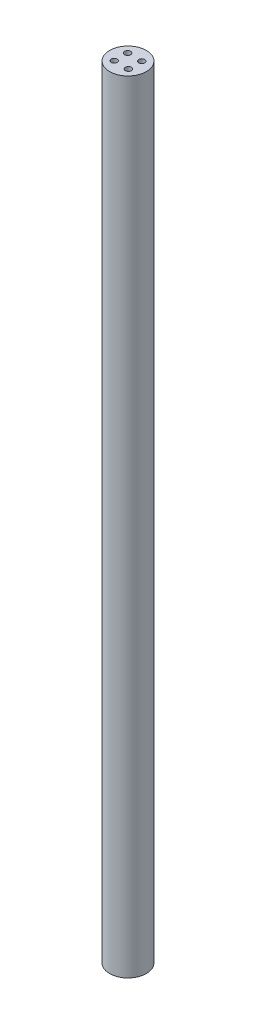
from build123d import *

# Parameters (mm, degrees)
SKETCH1_R           = 2.3876
BOSS_EXTRUDE1_DEPTH = 101.6
SKETCH2_R           = 0.3937
CUT_EXTRUDE1_DEPTH  = 102.656093116


with BuildPart() as part:
    # Sketch1 → Boss-Extrude1 (new body)
    with BuildSketch(Plane(origin=(0, 0, 0), x_dir=(1, 0, 0), z_dir=(0, 1, 0))):
        with Locations(Location((0, 0, 0), (0, 0, 270))):
            Circle(SKETCH1_R)
    extrude(amount=BOSS_EXTRUDE1_DEPTH)

    # Sketch2 → Cut-Extrude1 (cut, through all)
    with BuildSketch(Plane(origin=(0, 101.6, 0), x_dir=(1, 0, 0), z_dir=(0, 1, 0))):
        with Locations(Location((-0.923475175, 0.871833471, 0), (0, 0, 270))):
            Circle(SKETCH2_R)
        with Locations(Location((0.923475175, 0.871833471, 0), (0, 0, 270))):
            Circle(SKETCH2_R)
        with Locations(Location((0.923475175, -0.871833471, 0), (0, 0, 270))):
            Circle(SKETCH2_R)
        with Locations(Location((-0.923475175, -0.871833471, 0), (0, 0, 270))):
            Circle(SKETCH2_R)
    extrude(amount=-CUT_EXTRUDE1_DEPTH, mode=Mode.SUBTRACT)


solid = part.part
